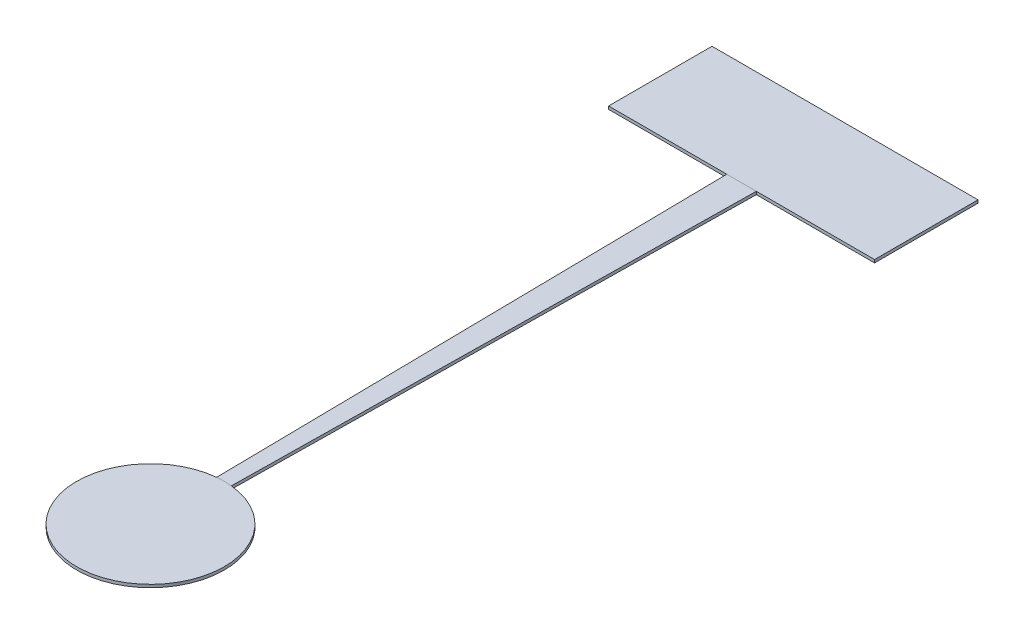
from build123d import *

# Parameters (mm, degrees)
EXTRUDE_1_DEPTH = 0.2


with BuildPart() as part:
    # 草图1 → 凸台-拉伸1 (new body)
    with BuildSketch(Plane(origin=(0, 0, 0), x_dir=(1, 0, 0), z_dir=(0, 1, 0))):
        with BuildLine():
            Line((9, -3.5), (1, -3.5))
            Line((1, -3.5), (0.5, -38.525062814))
            ThreePointArc((0.5, -38.525062814), (0, -48.5), (-0.5, -38.525062814))
            Line((-0.5, -38.525062814), (-1, -3.5))
            Line((-1, -3.5), (-9, -3.5))
            Line((-9, -3.5), (-9, 3.5))
            Line((-9, 3.5), (9, 3.5))
            Line((9, 3.5), (9, -3.5))
        make_face()
    extrude(amount=EXTRUDE_1_DEPTH)


solid = part.part
